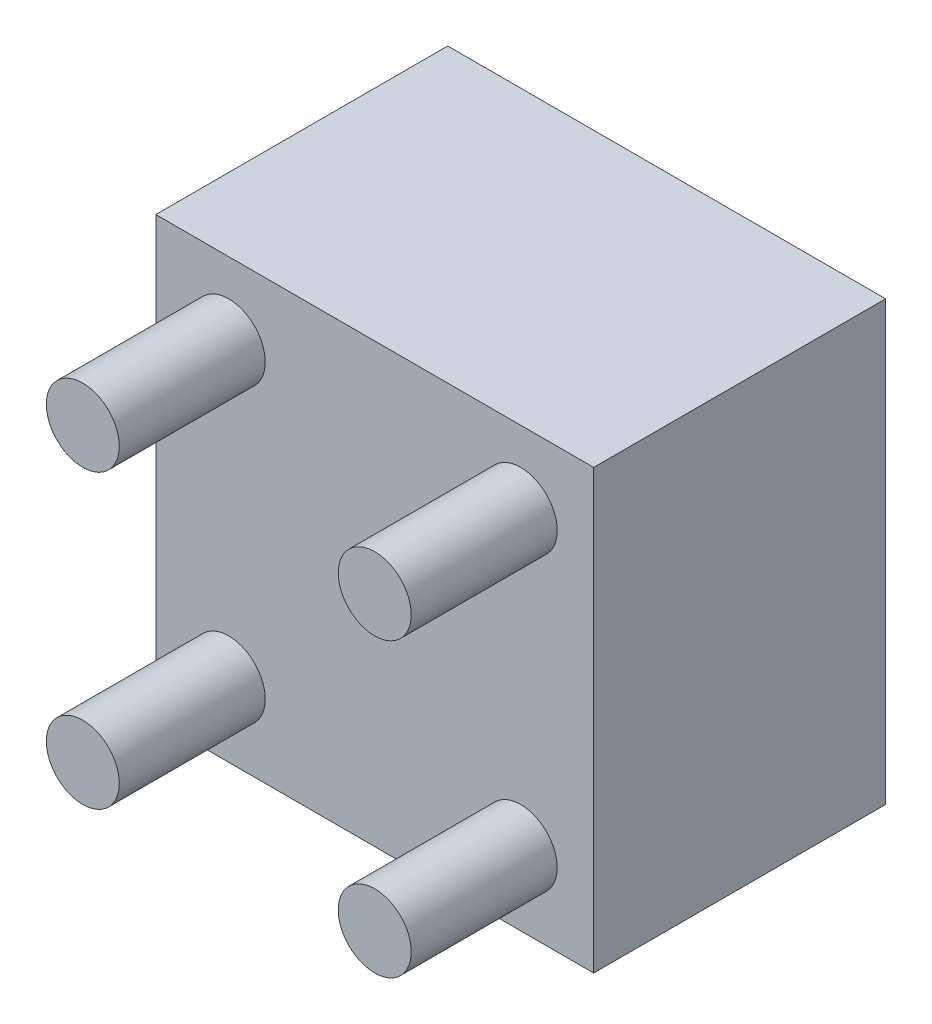
from build123d import *

# Parameters (mm, degrees)
SKETCH1_W           = 60
SKETCH1_H           = 60
BOSS_EXTRUDE1_DEPTH = 40
SKETCH6_R           = 5
BOSS_EXTRUDE3_DEPTH = 20


with BuildPart() as part:
    # Sketch1 → Boss-Extrude1 (new body)
    with BuildSketch(Plane.XY):
        with Locations((-0.814479638, -11.402714932)):
            Rectangle(SKETCH1_W, SKETCH1_H)
    extrude(amount=BOSS_EXTRUDE1_DEPTH)

    # Sketch6 → Boss-Extrude3 (add)
    with BuildSketch(Plane.XY.offset(40)):
        with Locations((-20.814479638, 8.597285068)):
            Circle(SKETCH6_R)
        with Locations((19.185520362, 8.597285068)):
            Circle(SKETCH6_R)
        with Locations((19.185520362, -31.402714932)):
            Circle(SKETCH6_R)
        with Locations((-20.814479638, -31.402714932)):
            Circle(SKETCH6_R)
    extrude(amount=BOSS_EXTRUDE3_DEPTH)


solid = part.part
